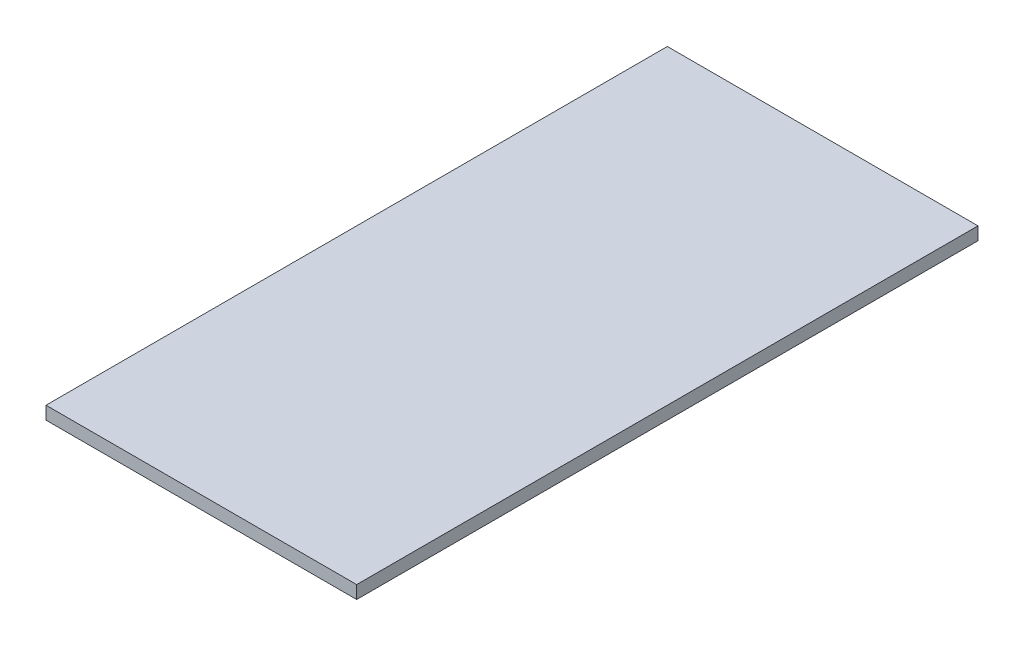
from build123d import *

# Parameters (mm, degrees)
SKETCH1_W           = 76.2
SKETCH1_H           = 152.4
BOSS_EXTRUDE1_DEPTH = 3.175


with BuildPart() as part:
    # Sketch1 → Boss-Extrude1 (new body)
    with BuildSketch(Plane(origin=(0, 0, 0), x_dir=(1, 0, 0), z_dir=(0, 1, 0))):
        with Locations((38.1, 76.2)):
            Rectangle(SKETCH1_W, SKETCH1_H)
    extrude(amount=BOSS_EXTRUDE1_DEPTH)


solid = part.part
